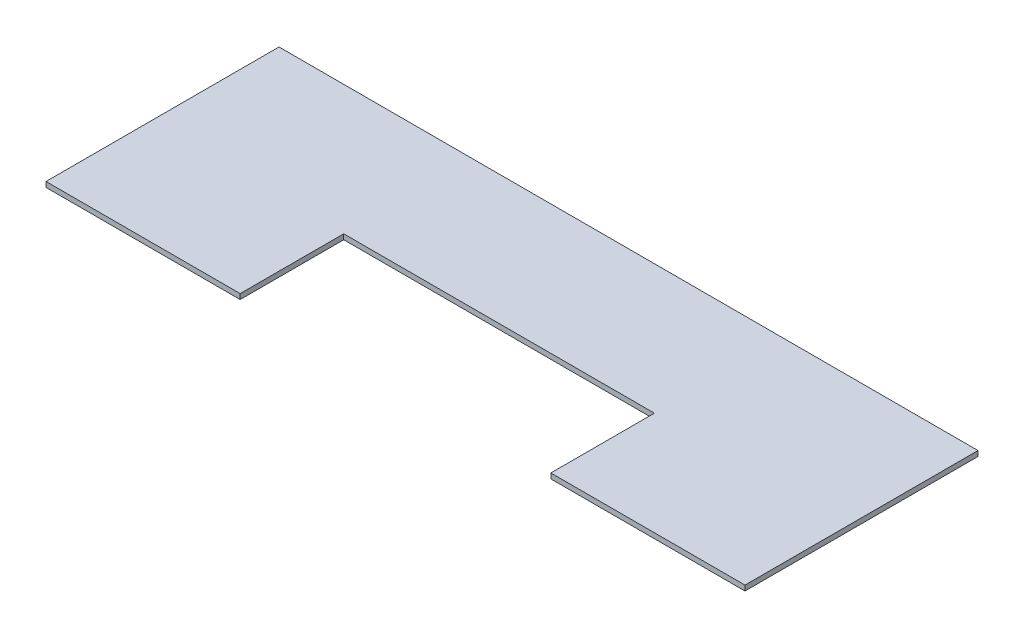
from build123d import *

# Parameters (mm, degrees)
EXTRUDE_1_DEPTH = 1


with BuildPart() as part:
    # 草图1 → 凸台-拉伸1 (new body)
    with BuildSketch(Plane(origin=(0, 0, 0), x_dir=(1, 0, 0), z_dir=(0, 1, 0))):
        Polygon((67.5, 22.5), (-67.5, 22.5), (-67.5, -22.5), (-30, -22.5), (-30, -2.5), (30, -2.5), (30, -22.5), (67.5, -22.5), align=None)
    extrude(amount=EXTRUDE_1_DEPTH)


solid = part.part
